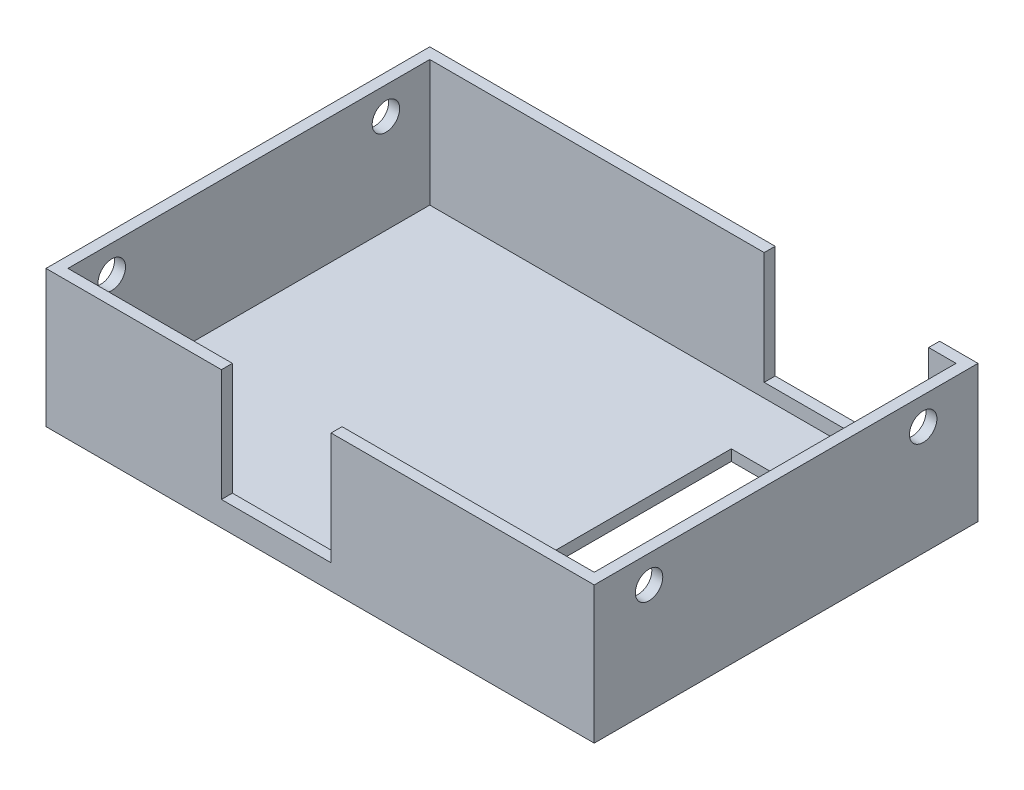
from build123d import *

# Parameters (mm, degrees)
SKETCH1_W           = 127
SKETCH1_H           = 88.9
BOSS_EXTRUDE1_DEPTH = 31.75
SHELL1_T            = -2.54
SKETCH3_R           = 3.175
CUT_EXTRUDE2_DEPTH  = 31.75
SKETCH4_W           = 38.1
SKETCH4_H           = 26.035
CUT_EXTRUDE3_DEPTH  = 2.54
SKETCH5_W           = 25.4
SKETCH5_H           = 26.035
CUT_EXTRUDE4_DEPTH  = 2.54
SKETCH6_W           = 25.4
SKETCH6_H           = 63.5
CUT_EXTRUDE5_DEPTH  = 2.54


with BuildPart() as part:
    # Sketch1 → Boss-Extrude1 (new body)
    with BuildSketch(Plane(origin=(0, 0, 0), x_dir=(1, 0, 0), z_dir=(0, 1, 0))):
        with Locations((63.5, 44.45)):
            Rectangle(SKETCH1_W, SKETCH1_H)
    extrude(amount=BOSS_EXTRUDE1_DEPTH)

    # Shell1
    shell1_openings = [part.faces().sort_by_distance(p)[0] for p in [
        (63.5, 31.75, -44.45),
    ]]
    offset(amount=SHELL1_T, openings=shell1_openings, kind=Kind.INTERSECTION)

    # Sketch3 → Cut-Extrude2 (cut)
    with BuildSketch(Plane(origin=(127, 0, 0), x_dir=(0, 0, -1), z_dir=(1, 0, 0))):
        with Locations((12.7, 25.4)):
            Circle(SKETCH3_R)
        with Locations((76.2, 25.4)):
            Circle(SKETCH3_R)
    cut_extrude2 = extrude(amount=-CUT_EXTRUDE2_DEPTH, mode=Mode.SUBTRACT)

    # Mirror2: Cut-Extrude2 across plane
    add(cut_extrude2.mirror(Plane(origin=(63.5, 0, 0), x_dir=(0, 0, 1), z_dir=(1, 0, 0))), mode=Mode.SUBTRACT)

    # Sketch4 → Cut-Extrude3 (cut)
    with BuildSketch(Plane(origin=(0, 0, -88.9), x_dir=(-1, 0, 0), z_dir=(0, 0, -1))):
        with Locations((-99.06, 18.7325)):
            Rectangle(SKETCH4_W, SKETCH4_H)
    extrude(amount=-CUT_EXTRUDE3_DEPTH, mode=Mode.SUBTRACT)

    # Sketch5 → Cut-Extrude4 (cut)
    with BuildSketch(Plane.XY):
        with Locations((53.34, 18.7325)):
            Rectangle(SKETCH5_W, SKETCH5_H)
    extrude(amount=-CUT_EXTRUDE4_DEPTH, mode=Mode.SUBTRACT)

    # Sketch6 → Cut-Extrude5 (cut)
    with BuildSketch(Plane.XZ):
        with Locations((99.06, -40.64)):
            Rectangle(SKETCH6_W, SKETCH6_H)
    extrude(amount=-CUT_EXTRUDE5_DEPTH, mode=Mode.SUBTRACT)


solid = part.part
